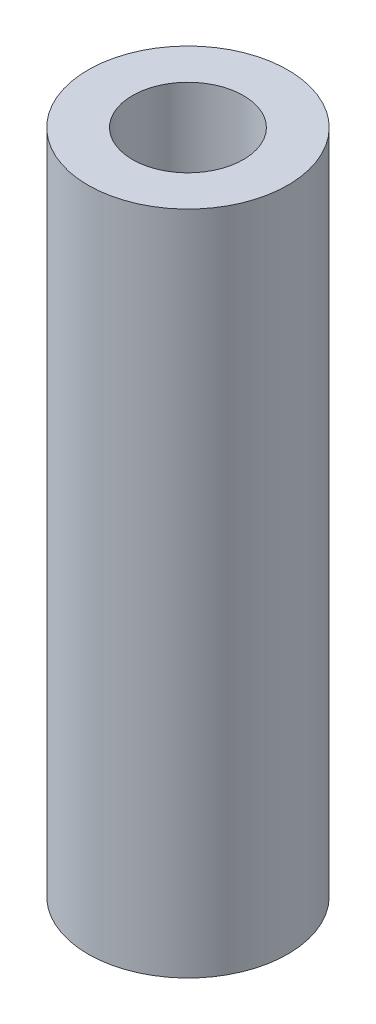
from build123d import *

# Parameters (mm, degrees)
SKETCH1_R           = 2.25
SKETCH1_R_2         = 1.25
BOSS_EXTRUDE1_DEPTH = 15


with BuildPart() as part:
    # Sketch1 → Boss-Extrude1 (new body)
    with BuildSketch(Plane(origin=(0, 0, 0), x_dir=(1, 0, 0), z_dir=(0, 1, 0))):
        with Locations(Location((0, 0, 0), (0, 0, 270))):
            Circle(SKETCH1_R)
        with Locations(Location((0, 0, 0), (0, 0, 270))):
            Circle(SKETCH1_R_2, mode=Mode.SUBTRACT)
    extrude(amount=BOSS_EXTRUDE1_DEPTH)


solid = part.part
